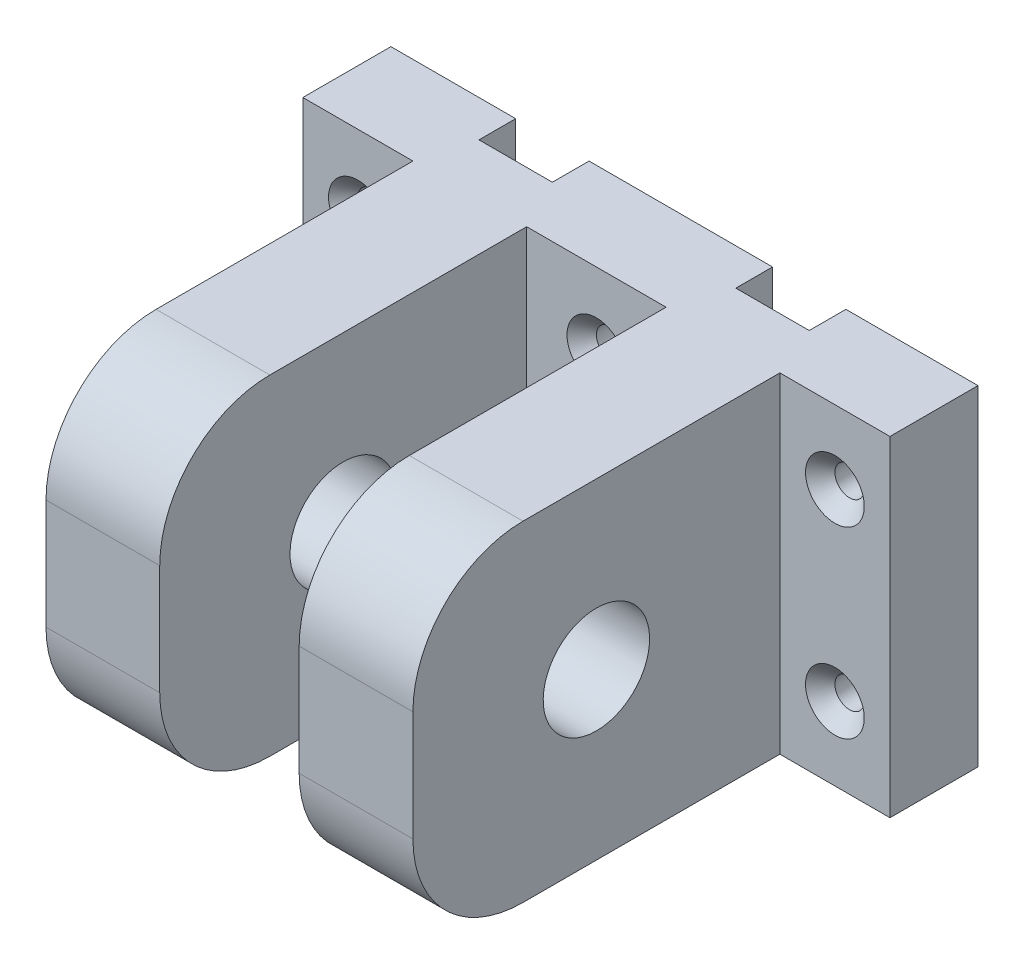
from build123d import *

# Parameters (mm, degrees)
SKETCH1_W           = 80
SKETCH1_H           = 45
BOSS_EXTRUDE1_DEPTH = 12
SKETCH2_W           = 15.5
SKETCH2_H           = 45
BOSS_EXTRUDE2_DEPTH = 50
SKETCH3_R           = 7.25
CUT_EXTRUDE1_DEPTH  = 50
FILLET1_R           = 15
SKETCH5_R           = 2
CUT_EXTRUDE2_DEPTH  = 50
CHAMFER1_SIZE       = 2
SKETCH6_W           = 10
SKETCH6_H           = 12
CUT_EXTRUDE3_DEPTH  = 5


with BuildPart() as part:
    # Sketch1 → Boss-Extrude1 (new body)
    with BuildSketch(Plane.XY):
        with Locations((40, 22.5)):
            Rectangle(SKETCH1_W, SKETCH1_H)
    extrude(amount=BOSS_EXTRUDE1_DEPTH)

    # Sketch2 → Boss-Extrude2 (add)
    with BuildSketch(Plane.XY.offset(12)):
        with Locations((22.75, 22.5)):
            Rectangle(SKETCH2_W, SKETCH2_H)
        with Locations((57.25, 22.5)):
            Rectangle(SKETCH2_W, SKETCH2_H)
    extrude(amount=BOSS_EXTRUDE2_DEPTH)

    # Sketch3 → Cut-Extrude1 (cut)
    with BuildSketch(Plane.ZY.offset(-15)):
        with Locations(Location((37, 22.5, 0), (0, 0, 270))):
            Circle(SKETCH3_R)
    extrude(amount=-CUT_EXTRUDE1_DEPTH, mode=Mode.SUBTRACT)

    # Fillet1
    fillet1_edges = [part.edges().sort_by_distance(p)[0] for p in [
        (22.75, 0, 62),
        (22.75, 45, 62),
        (57.25, 0, 62),
        (57.25, 45, 62),
    ]]
    fillet(fillet1_edges, radius=FILLET1_R)

    # Sketch5 → Cut-Extrude2 (cut)
    with BuildSketch(Plane.XY.offset(12)):
        with Locations((7.5, 35)):
            Circle(SKETCH5_R)
        with Locations((7.5, 10)):
            Circle(SKETCH5_R)
        with Locations((40, 35)):
            Circle(SKETCH5_R)
        with Locations((40, 10)):
            Circle(SKETCH5_R)
        with Locations((72.5, 35)):
            Circle(SKETCH5_R)
        with Locations((72.5, 10)):
            Circle(SKETCH5_R)
    extrude(amount=-CUT_EXTRUDE2_DEPTH, mode=Mode.SUBTRACT)

    # Chamfer1
    chamfer1_edges = [part.edges().sort_by_distance(p)[0] for p in [
        (5.5, 35, 12),
        (70.5, 10, 12),
        (70.5, 35, 12),
        (38, 10, 12),
        (38, 35, 12),
        (5.5, 10, 12),
    ]]
    chamfer(chamfer1_edges, length=CHAMFER1_SIZE)

    # Sketch6 → Cut-Extrude3 (cut)
    with BuildSketch(Plane(origin=(0, 0, 0), x_dir=(-1, 0, 0), z_dir=(0, 0, -1))):
        with Locations((-22, 6)):
            Rectangle(SKETCH6_W, SKETCH6_H)
        with Locations((-57, 6)):
            Rectangle(SKETCH6_W, SKETCH6_H)
        with Locations((-57, 39)):
            Rectangle(SKETCH6_W, SKETCH6_H)
        with Locations((-22, 39)):
            Rectangle(SKETCH6_W, SKETCH6_H)
    extrude(amount=-CUT_EXTRUDE3_DEPTH, mode=Mode.SUBTRACT)


solid = part.part
